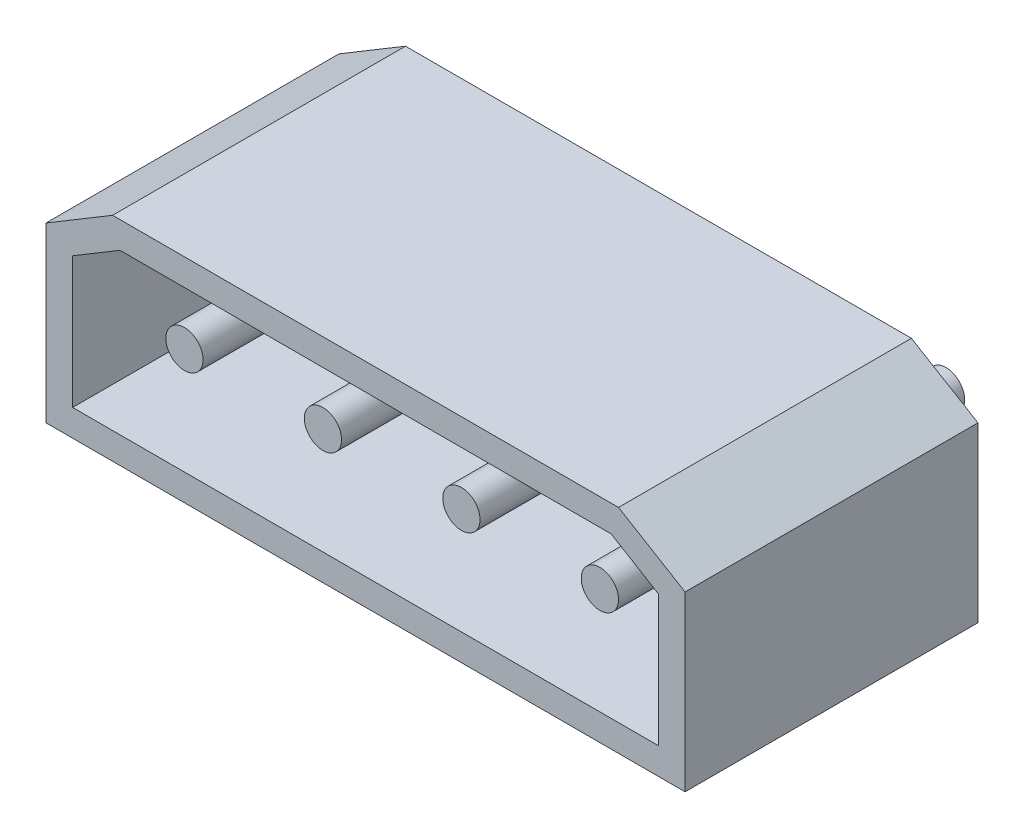
from build123d import *

# Parameters (mm, degrees)
EXTRUDE_1_DEPTH        = 11
CUT_EXTRUDE_1_DEPTH    = 9
SKETCH_3_R             = 0.7
EXTRUDE_2_DEPTH        = 8
SKETCH_4_R             = 1.576566923
CUT_EXTRUDE_2_DEPTH    = 3
PATTERN_LINEAR_1_COUNT = 4
PATTERN_LINEAR_1_PITCH = 5.2


with BuildPart() as part:
    # Model → 凸台-拉伸1 (new body)
    with BuildSketch(Plane.XY):
        Polygon((2890.278305735, 1611.212566626), (2909.278305735, 1611.212566626), (2911.778305735, 1609.712566626), (2911.778305735, 1603.212566626), (2887.778305735, 1603.212566626), (2887.778305735, 1609.712566626), align=None)
    extrude(amount=EXTRUDE_1_DEPTH)

    # 草图2 → 切除-拉伸1 (cut)
    with BuildSketch(Plane.XY.offset(11)):
        Polygon((2890.5552897, 1610.212566626), (2888.778305735, 1609.146376247), (2888.778305735, 1604.212566626), (2910.778305735, 1604.212566626), (2910.778305735, 1609.146376247), (2909.00132177, 1610.212566626), align=None)
    extrude(amount=-CUT_EXTRUDE_1_DEPTH, mode=Mode.SUBTRACT)

    # 草图3 → 凸台-拉伸2 (add, symmetric)
    with BuildSketch(Plane.XY.offset(2)):
        with Locations((2891.978305735, 1607.212566626)):
            Circle(SKETCH_3_R)
    extrude_2 = extrude(amount=EXTRUDE_2_DEPTH, both=True)

    # 草图4 → 切除-拉伸2 (cut)
    with BuildSketch(Plane(origin=(0, 0, -6), x_dir=(-1, 0, 0), z_dir=(0, 0, -1))):
        with Locations((-2891.978305735, 1607.212566626)):
            Circle(SKETCH_4_R)
    cut_extrude_2 = extrude(amount=-CUT_EXTRUDE_2_DEPTH, mode=Mode.SUBTRACT)

    # 阵列(线性)1: 凸台-拉伸2, 切除-拉伸2 ×4
    with Locations(*[(i * PATTERN_LINEAR_1_PITCH, 0, 0) for i in range(1, PATTERN_LINEAR_1_COUNT)]):
        add(extrude_2)
        add(cut_extrude_2, mode=Mode.SUBTRACT)


solid = part.part
